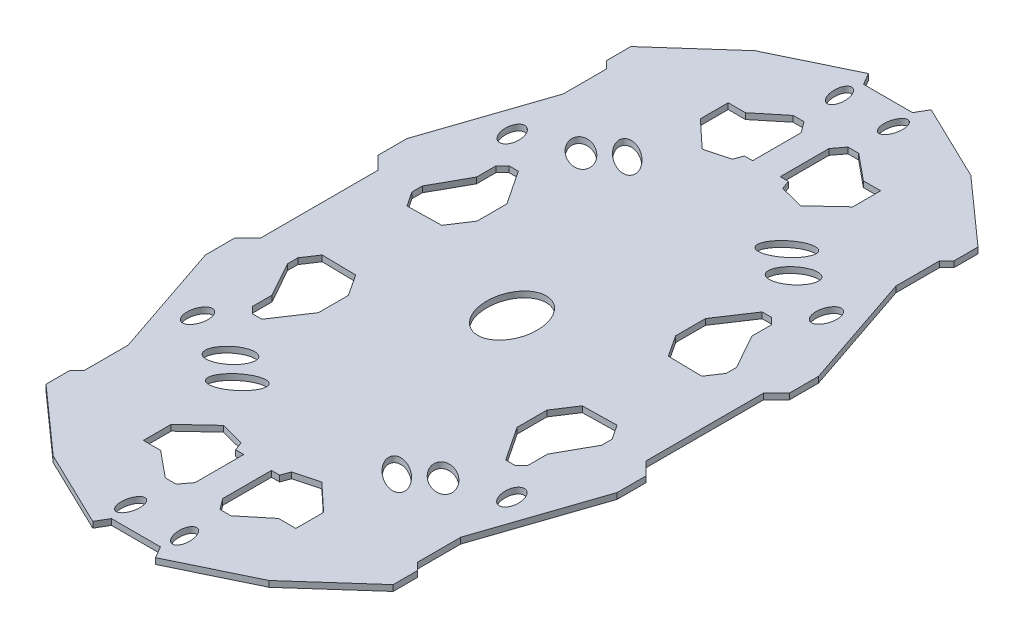
from build123d import *

# Parameters (mm, degrees)
SKETCH3_RX          = 5.624926532
SKETCH3_RY          = 3.004692616
SKETCH3_RX_2        = 9.556829234
SKETCH3_RY_2        = 4.328681477
SKETCH3_RX_3        = 8.492460802
SKETCH3_RY_3        = 4.684720213
SKETCH3_RX_4        = 5.848490675
SKETCH3_RY_4        = 3.57108896
SKETCH3_RX_5        = 14.471517628
SKETCH3_RY_5        = 10.662983723
BOSS_EXTRUDE2_DEPTH = 2.5


with BuildPart() as part:
    # Sketch3 → Boss-Extrude2 (new body)
    with BuildSketch(Plane(origin=(0, 0, 0), x_dir=(1, 0, 0), z_dir=(0, 1, 0))):
        Polygon((10.338651831, 158.825979178), (13.264554689, 163.800014037), (45.578225854, 148.199099997), (73.311205528, 123.503793754), (73.311205528, 113.306124028), (70.253487054, 110.248405554), (70.253487054, 91.907219464), (73.927331416, 81.033815485), (86.933442966, 42.539886198), (86.933442966, 30.301657501), (81.461542635, 24.829757171), (81.461542635, -24.829757171), (86.933442966, -30.301657501), (86.933442966, -42.539886198), (73.927331416, -81.033815485), (70.253487054, -91.907219464), (70.253487054, -110.248405554), (73.311205528, -113.306124028), (73.311205528, -123.503793754), (45.578225854, -148.199099997), (13.264554689, -163.800014037), (10.338651831, -158.825979178), (-10.338651831, -158.825979178), (-13.264554689, -163.800014037), (-45.578225854, -148.199099997), (-73.311205528, -123.503793754), (-73.311205528, -113.306124028), (-70.253487054, -110.248405554), (-70.253487054, -91.907219464), (-73.927331416, -81.033815485), (-86.933442966, -42.539886198), (-86.933442966, -30.301657501), (-81.461542635, -24.829757171), (-81.461542635, 24.829757171), (-86.933442966, 30.301657501), (-86.933442966, 42.539886198), (-73.927331416, 81.033815485), (-70.253487054, 91.907219464), (-70.253487054, 110.248405554), (-73.311205528, 113.306124028), (-73.311205528, 123.503793754), (-45.578225854, 148.199099997), (-13.264554689, 163.800014037), (-10.338651831, 158.825979178), align=None)
        with Locations(Location((11.385123615, 149.68538673), (0, 0, 83.157226587))):
            Ellipse(SKETCH3_RX, SKETCH3_RY, mode=Mode.SUBTRACT)
        with Locations(Location((33.692455497, 82.363006755), (0, 0, 39.093858886))):
            Ellipse(SKETCH3_RX_2, SKETCH3_RY_2, mode=Mode.SUBTRACT)
        with Locations(Location((44.895501329, 74.018669169), (0, 0, 39.093858886))):
            Ellipse(SKETCH3_RX_3, SKETCH3_RY_3, mode=Mode.SUBTRACT)
        with Locations(Location((66.355525512, 66.446955434), (0, 0, 82.221640152))):
            Ellipse(SKETCH3_RX_4, SKETCH3_RY_4, mode=Mode.SUBTRACT)
        with Locations(Location((-66.355525512, 66.446955434), (0, 0, 97.778359848))):
            Ellipse(SKETCH3_RX_4, SKETCH3_RY_4, mode=Mode.SUBTRACT)
        with Locations(Location((-44.895501329, 74.018669169), (0, 0, 140.906141114))):
            Ellipse(SKETCH3_RX_3, SKETCH3_RY_3, mode=Mode.SUBTRACT)
        with Locations(Location((-33.692455497, 82.363006755), (0, 0, 140.906141114))):
            Ellipse(SKETCH3_RX_2, SKETCH3_RY_2, mode=Mode.SUBTRACT)
        with Locations(Location((-11.385123615, 149.68538673), (0, 0, 96.842773413))):
            Ellipse(SKETCH3_RX, SKETCH3_RY, mode=Mode.SUBTRACT)
        with Locations(Location((-11.385123615, -149.68538673), (0, 0, -96.842773413))):
            Ellipse(SKETCH3_RX, SKETCH3_RY, mode=Mode.SUBTRACT)
        with Locations(Location((-33.692455497, -82.363006755), (0, 0, -140.906141114))):
            Ellipse(SKETCH3_RX_2, SKETCH3_RY_2, mode=Mode.SUBTRACT)
        with Locations(Location((-44.895501329, -74.018669169), (0, 0, -140.906141114))):
            Ellipse(SKETCH3_RX_3, SKETCH3_RY_3, mode=Mode.SUBTRACT)
        with Locations(Location((-66.355525512, -66.446955434), (0, 0, -97.778359848))):
            Ellipse(SKETCH3_RX_4, SKETCH3_RY_4, mode=Mode.SUBTRACT)
        with Locations(Location((66.355525512, -66.446955434), (0, 0, -82.221640152))):
            Ellipse(SKETCH3_RX_4, SKETCH3_RY_4, mode=Mode.SUBTRACT)
        with Locations(Location((44.895501329, -74.018669169), (0, 0, -39.093858886))):
            Ellipse(SKETCH3_RX_3, SKETCH3_RY_3, mode=Mode.SUBTRACT)
        with Locations(Location((33.692455497, -82.363006755), (0, 0, -39.093858886))):
            Ellipse(SKETCH3_RX_2, SKETCH3_RY_2, mode=Mode.SUBTRACT)
        with Locations(Location((11.385123615, -149.68538673), (0, 0, -83.157226587))):
            Ellipse(SKETCH3_RX, SKETCH3_RY, mode=Mode.SUBTRACT)
        with Locations(Location((0, 0), (0, 0, 90))):
            Ellipse(SKETCH3_RX_5, SKETCH3_RY_5, mode=Mode.SUBTRACT)
        Polygon((5.834875923, 128.014628126), (5.834875923, 107.44522339), (9.270194242, 107.44522339), (10.662983723, 103.716266976), (20.757785776, 101.069910811), (32.198995676, 111.76010755), (32.198995676, 123.503793754), (24.907753398, 123.503793754), (13.841173073, 132.585606956), (9.270194242, 132.585606956), align=None, mode=Mode.SUBTRACT)
        Polygon((41.941351313, 39.789061162), (51.486619053, 54.160218526), (55.402714886, 54.160218526), (58.163676153, 51.399257259), (58.163676153, 43.187167337), (66.355525512, 28.46204058), (66.355525512, 24.072820104), (62.259600832, 17.90608076), (47.849651346, 18.166894335), (41.941351313, 27.187750764), align=None, mode=Mode.SUBTRACT)
        Polygon((-41.941351313, 27.187750764), (-41.941351313, 39.789061162), (-51.486619053, 54.160218526), (-55.402714886, 54.160218526), (-58.163676153, 51.399257259), (-58.163676153, 43.187167337), (-66.355525512, 28.46204058), (-66.355525512, 24.072820104), (-62.259600832, 17.90608076), (-47.849651346, 18.166894335), align=None, mode=Mode.SUBTRACT)
        Polygon((-9.270194242, 132.585606956), (-5.834875923, 128.014628126), (-5.834875923, 107.44522339), (-9.270194242, 107.44522339), (-10.662983723, 103.716266976), (-20.757785776, 101.069910811), (-32.198995676, 111.76010755), (-32.198995676, 123.503793754), (-24.907753398, 123.503793754), (-13.841173073, 132.585606956), align=None, mode=Mode.SUBTRACT)
        Polygon((-5.834875923, -128.014628126), (-5.834875923, -107.44522339), (-9.270194242, -107.44522339), (-10.662983723, -103.716266976), (-20.757785776, -101.069910811), (-32.198995676, -111.76010755), (-32.198995676, -123.503793754), (-24.907753398, -123.503793754), (-13.841173073, -132.585606956), (-9.270194242, -132.585606956), align=None, mode=Mode.SUBTRACT)
        Polygon((-41.941351313, -39.789061162), (-51.486619053, -54.160218526), (-55.402714886, -54.160218526), (-58.163676153, -51.399257259), (-58.163676153, -43.187167337), (-66.355525512, -28.46204058), (-66.355525512, -24.072820104), (-62.259600832, -17.90608076), (-47.849651346, -18.166894335), (-41.941351313, -27.187750764), align=None, mode=Mode.SUBTRACT)
        Polygon((41.941351313, -27.187750764), (41.941351313, -39.789061162), (51.486619053, -54.160218526), (55.402714886, -54.160218526), (58.163676153, -51.399257259), (58.163676153, -43.187167337), (66.355525512, -28.46204058), (66.355525512, -24.072820104), (62.259600832, -17.90608076), (47.849651346, -18.166894335), align=None, mode=Mode.SUBTRACT)
        Polygon((9.270194242, -132.585606956), (5.834875923, -128.014628126), (5.834875923, -107.44522339), (9.270194242, -107.44522339), (10.662983723, -103.716266976), (20.757785776, -101.069910811), (32.198995676, -111.76010755), (32.198995676, -123.503793754), (24.907753398, -123.503793754), (13.841173073, -132.585606956), align=None, mode=Mode.SUBTRACT)
    extrude(amount=BOSS_EXTRUDE2_DEPTH)


solid = part.part
